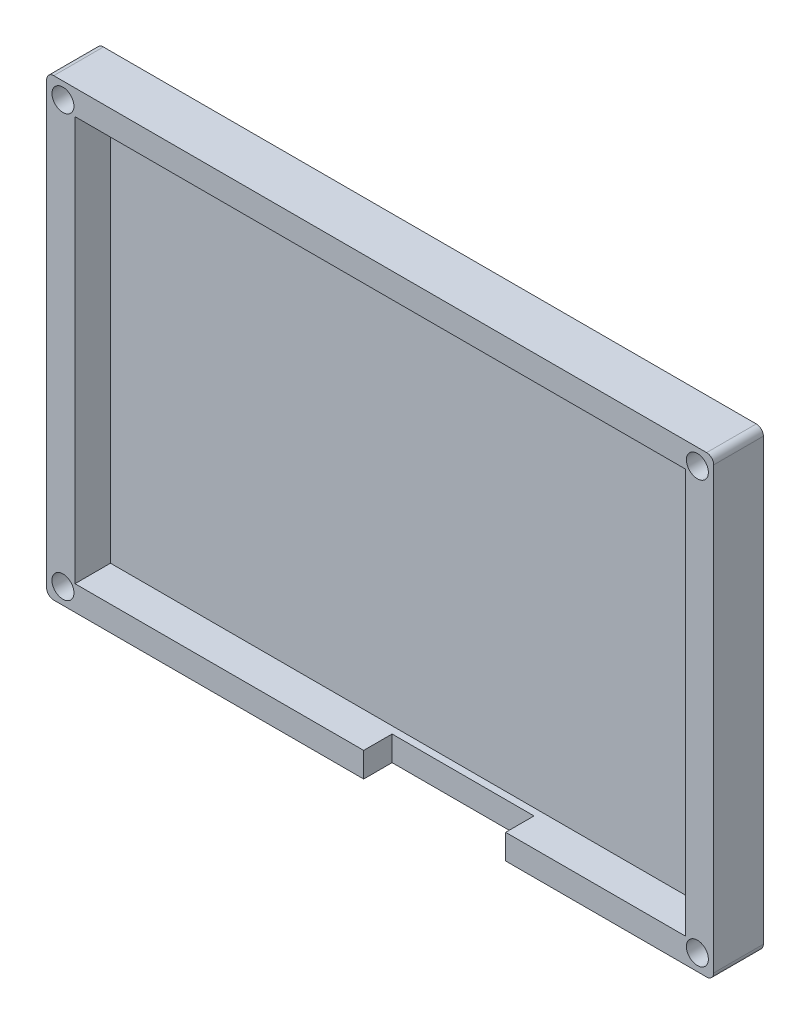
from build123d import *

# Parameters (mm, degrees)
SKETCH_1_W          = 94
SKETCH_1_H          = 64
EXTRUDE_1_DEPTH     = 7
FILLET_1_R          = 1
SKETCH_2_W          = 86
SKETCH_2_H          = 57
CUT_EXTRUDE_1_DEPTH = 5
SKETCH_3_R          = 1.55
CUT_EXTRUDE_2_DEPTH = 58.28874235
SKETCH_4_W          = 20
SKETCH_4_H          = 5
CUT_EXTRUDE_4_DEPTH = 5


with BuildPart() as part:
    # 草图1 → 凸台-拉伸1 (new body)
    with BuildSketch(Plane.XY):
        Rectangle(SKETCH_1_W, SKETCH_1_H)
    extrude(amount=EXTRUDE_1_DEPTH)

    # 圆角1
    fillet_1_edges = [part.edges().sort_by_distance(p)[0] for p in [
        (47, -32, 3.5),
        (-47, -32, 3.5),
        (-47, 32, 3.5),
        (47, 32, 3.5),
    ]]
    fillet(fillet_1_edges, radius=FILLET_1_R)

    # 草图2 → 切除-拉伸1 (cut)
    with BuildSketch(Plane.XY.offset(7)):
        Rectangle(SKETCH_2_W, SKETCH_2_H)
    extrude(amount=-CUT_EXTRUDE_1_DEPTH, mode=Mode.SUBTRACT)

    # 草图3 → 切除-拉伸2 (cut, through all)
    with BuildSketch(Plane.XY.offset(7)):
        with Locations((-44.7, 29.7)):
            Circle(SKETCH_3_R)
        with Locations(Location((44.7, 29.7, 0), (0, 0, 180))):
            Circle(SKETCH_3_R)
        with Locations((44.7, -29.7)):
            Circle(SKETCH_3_R)
        with Locations(Location((-44.7, -29.7, 0), (0, 0, 180))):
            Circle(SKETCH_3_R)
    extrude(amount=-CUT_EXTRUDE_2_DEPTH, mode=Mode.SUBTRACT)

    # 草图4 → 切除-拉伸4 (cut)
    with BuildSketch(Plane.XZ.offset(32)):
        with Locations((7.68, 5.5)):
            Rectangle(SKETCH_4_W, SKETCH_4_H)
    extrude(amount=-CUT_EXTRUDE_4_DEPTH, mode=Mode.SUBTRACT)


solid = part.part
